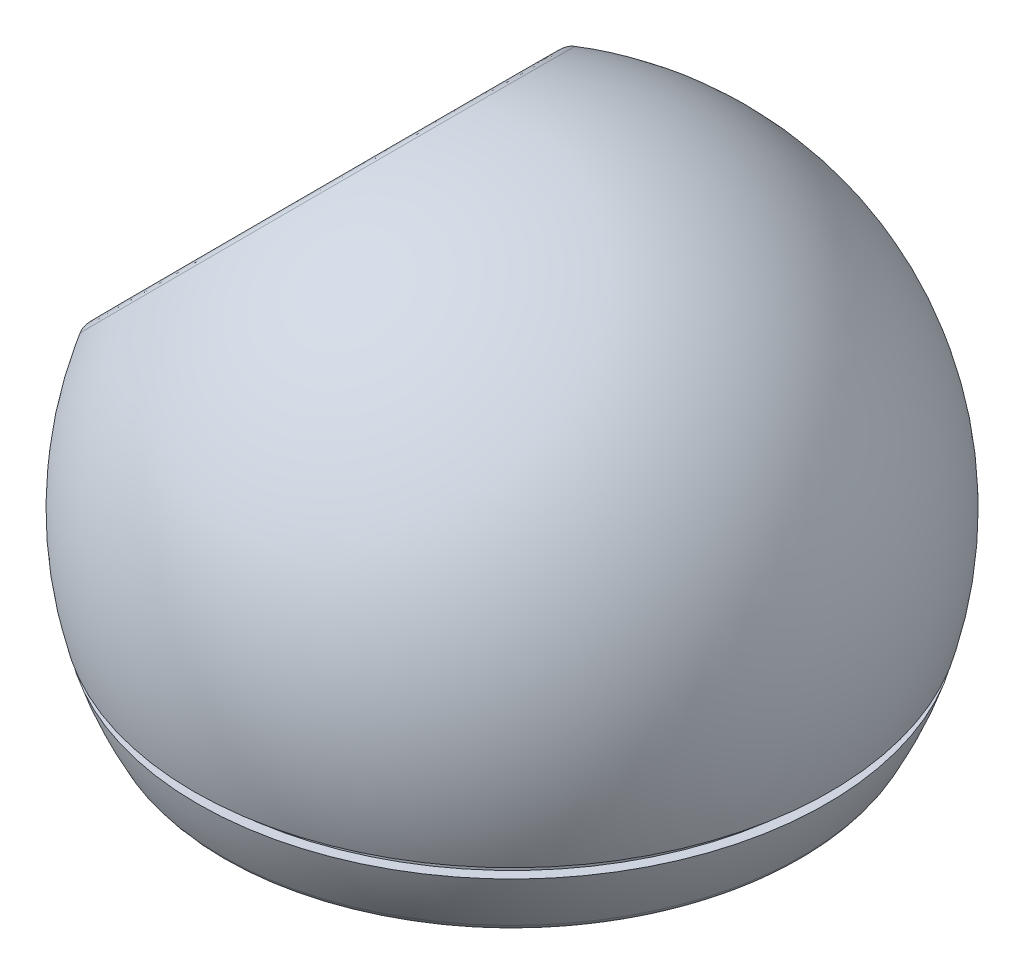
from build123d import *

# Parameters (mm, degrees)
CUT_EXTRUDE1_DEPTH      = 70.282032303
CUT_EXTRUDE1_DEPTH_BACK = 70.282032303
SKETCH3_W               = 80
SKETCH3_H               = 50
CUT_EXTRUDE2_DEPTH      = 70.282032303
CUT_EXTRUDE2_DEPTH_BACK = 70.282032303
CUT_EXTRUDE3_DEPTH      = 1
SKETCH6_R               = 1
CUT_EXTRUDE4_DEPTH      = 1
FILLET1_R               = 2
SKETCH7_W               = 3
SKETCH7_H               = 1.5
FILLET2_R               = 2


with BuildPart() as part:
    # Sketch2 → Revolve4 (revolve)
    with BuildSketch(Plane(origin=(0, 0, 0), x_dir=(0, 0, -1), z_dir=(1, 0, 0))):
        with BuildLine():
            Line((0, 40), (0, -40))
            ThreePointArc((0, -40), (-40, 0), (0, 40))
        make_face()
    revolve(axis=Axis((0, 0, 0), (0, 1, 0)))

    # Sketch3 → Cut-Extrude1 (cut, two sides: drawn at the far end of the back side and taken through both)
    with BuildSketch(Plane.XY.offset(-CUT_EXTRUDE1_DEPTH_BACK)):
        with Locations((0, -45)):
            Rectangle(SKETCH3_W, SKETCH3_H)
    extrude(amount=CUT_EXTRUDE1_DEPTH + CUT_EXTRUDE1_DEPTH_BACK, mode=Mode.SUBTRACT)

    # Sketch4 → Cut-Extrude2 (cut, two sides: drawn at the far end of the back side and taken through both)
    with BuildSketch(Plane.XY.offset(-CUT_EXTRUDE2_DEPTH_BACK)):
        Polygon((-40.264401604, 4.909155965), (-4.990432392, 40.34567803), (-21.331481222, 54.070064096), (-80.21701071, 4.909155965), align=None)
    extrude(amount=CUT_EXTRUDE2_DEPTH + CUT_EXTRUDE2_DEPTH_BACK, mode=Mode.SUBTRACT)

    # Sketch5 → Cut-Extrude3 (cut)
    with BuildSketch(Plane(origin=(-22.679314195, 22.575280643, 0), x_dir=(0, 0, 1), z_dir=(-0.708730441300506, 0.705479384230319, 0))):
        with BuildLine():
            Line((15.2, 11.2), (15.2, -11.2))
            ThreePointArc((15.2, -11.2), (13.442640687, -15.442640687), (9.2, -17.2))
            Line((9.2, -17.2), (-9.2, -17.2))
            ThreePointArc((-9.2, -17.2), (-13.442640687, -15.442640687), (-15.2, -11.2))
            Line((-15.2, -11.2), (-15.2, 11.2))
            ThreePointArc((-15.2, 11.2), (-13.442640687, 15.442640687), (-9.2, 17.2))
            Line((-9.2, 17.2), (9.2, 17.2))
            ThreePointArc((9.2, 17.2), (13.442640687, 15.442640687), (15.2, 11.2))
        make_face()
        with BuildLine():
            Line((-9.2, 16.2), (9.2, 16.2))
            ThreePointArc((9.2, 16.2), (12.735533906, 14.735533906), (14.2, 11.2))
            Line((14.2, 11.2), (14.2, -11.2))
            ThreePointArc((14.2, -11.2), (12.735533906, -14.735533906), (9.2, -16.2))
            Line((9.2, -16.2), (-9.2, -16.2))
            ThreePointArc((-9.2, -16.2), (-12.735533906, -14.735533906), (-14.2, -11.2))
            Line((-14.2, -11.2), (-14.2, 11.2))
            ThreePointArc((-14.2, 11.2), (-12.735533906, 14.735533906), (-9.2, 16.2))
        make_face(mode=Mode.SUBTRACT)
    extrude(amount=-CUT_EXTRUDE3_DEPTH, mode=Mode.SUBTRACT)

    # Sketch6 → Cut-Extrude4 (cut)
    with BuildSketch(Plane(origin=(-22.679314195, 22.575280643, 0), x_dir=(0, 0, 1), z_dir=(-0.708730441300506, 0.705479384230319, 0))):
        with Locations(Location((0, -20, 0), (0, 0, 270))):
            Circle(SKETCH6_R)
        with Locations(Location((3, -20, 0), (0, 0, 270))):
            Circle(SKETCH6_R)
        with Locations(Location((6, -20, 0), (0, 0, 270))):
            Circle(SKETCH6_R)
        with Locations(Location((-3, -20, 0), (0, 0, 270))):
            Circle(SKETCH6_R)
        with Locations(Location((-6, -20, 0), (0, 0, 270))):
            Circle(SKETCH6_R)
    extrude(amount=-CUT_EXTRUDE4_DEPTH, mode=Mode.SUBTRACT)

    # Fillet1
    fillet1_edges = [part.edges().sort_by_distance(p)[0] for p in [
        (-5.747729438, 39.584891137, 0),
    ]]
    fillet(fillet1_edges, radius=FILLET1_R)

    # Sketch7 → Cut-Revolve1 (revolve, cut)
    with BuildSketch(Plane(origin=(0, 0, 0), x_dir=(0, 0, -1), z_dir=(1, 0, 0))):
        with Locations((-38.385381332, -11.25)):
            Rectangle(SKETCH7_W, SKETCH7_H)
    revolve(axis=Axis((0, 0, 0), (0, 1, 0)), mode=Mode.SUBTRACT)

    # Fillet2
    fillet2_edges = [part.edges().sort_by_distance(p)[0] for p in [
        (0, -20, -34.641016151),
    ]]
    fillet(fillet2_edges, radius=FILLET2_R)


solid = part.part
